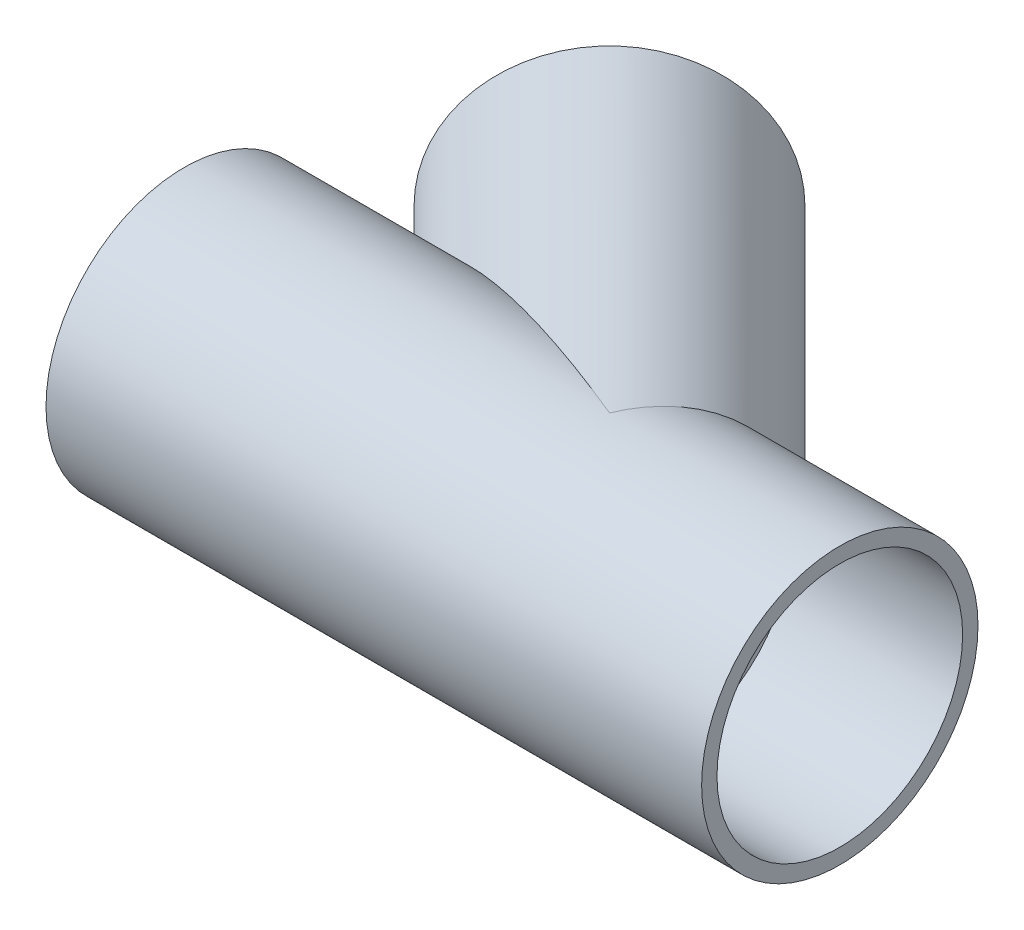
from build123d import *

# Parameters (mm, degrees)
SWEEP_1_PROFILE_R   = 18
SKETCH_35_R         = 18
EXTRUDE_1_DEPTH     = 85.4
SWEEP_1_2_PROFILE_R = 13.6
SKETCH_56_R         = 13.6
CUT_EXTRUDE_3_DEPTH = 103.698548903
SKETCH_33_R         = 16
CUT_EXTRUDE_1_DEPTH = 22.2
SKETCH_34_R         = 16
CUT_EXTRUDE_2_DEPTH = 22.2
CUT_EXTRUDE_START   = -22.2
SKETCH_56_4_R       = 16
CUT_EXTRUDE_4_DEPTH = 22.2


with BuildPart() as part:
    # Sweep 1: sweep along a path in 草图1
    with BuildLine(Plane(origin=(0, 0, 0), x_dir=(1, 0, 0), z_dir=(0, 1, 0))) as sweep_1_path:
        Line((-41.4, 41.4), (0, 0))
        Line((0, 0), (30, 0))
    # Sweep 1 profile (on start of the path) → Sweep 1 (sweep)
    with BuildSketch(Plane(origin=(-41.4, 0, -41.4), x_dir=(0.7071067811865488, 0, -0.7071067811865462), z_dir=(0.7071067811865462, 0, 0.7071067811865488))):
        Circle(SWEEP_1_PROFILE_R)
    sweep(path=sweep_1_path.line, transition=Transition.RIGHT)

    # 草图35 → 凸台-拉伸1 (add)
    with BuildSketch(Plane(origin=(30, 0, 0), x_dir=(0, 0, -1), z_dir=(1, 0, 0))):
        Circle(SKETCH_35_R)
    extrude(amount=-EXTRUDE_1_DEPTH)

    # Sweep 1 2: sweep along a path in 草图1<11>
    with BuildLine(Plane(origin=(0, 0, 0), x_dir=(1, 0, 0), z_dir=(0, 1, 0))) as sweep_1_2_path:
        Line((-41.4, 41.4), (0, 0))
        Line((0, 0), (30, 0))
    # Sweep 1 2 profile (on start of the path) → Sweep 1 2 (sweep, cut)
    with BuildSketch(Plane(origin=(-41.4, 0, -41.4), x_dir=(0.7071067811865488, 0, -0.7071067811865462), z_dir=(0.7071067811865462, 0, 0.7071067811865488))):
        Circle(SWEEP_1_2_PROFILE_R)
    sweep(path=sweep_1_2_path.line, transition=Transition.RIGHT, mode=Mode.SUBTRACT)

    # 草图56 → 切除-拉伸3 (cut, through all)
    with BuildSketch(Plane.ZY.offset(55.4)):
        Circle(SKETCH_56_R)
    extrude(amount=-CUT_EXTRUDE_3_DEPTH, mode=Mode.SUBTRACT)

    # 草图33 → 切除-拉伸1 (cut)
    with BuildSketch(Plane(origin=(30, 0, 0), x_dir=(0, 0, -1), z_dir=(1, 0, 0))):
        Circle(SKETCH_33_R)
    extrude(amount=-CUT_EXTRUDE_1_DEPTH, mode=Mode.SUBTRACT)

    # 草图34 → 切除-拉伸2 (cut)
    with BuildSketch(Plane(origin=(-41.4, 0, -41.4), x_dir=(-0.7071067811865486, 0, 0.7071067811865465), z_dir=(-0.7071067811865465, 0, -0.7071067811865486))):
        Circle(SKETCH_34_R)
    extrude(amount=-CUT_EXTRUDE_2_DEPTH, mode=Mode.SUBTRACT)

    # 草图56<4> → 切除-拉伸4 (cut)
    with BuildSketch(Plane.ZY.offset(55.4).offset(CUT_EXTRUDE_START)):
        Circle(SKETCH_56_4_R)
    extrude(amount=CUT_EXTRUDE_4_DEPTH, mode=Mode.SUBTRACT)


solid = part.part
